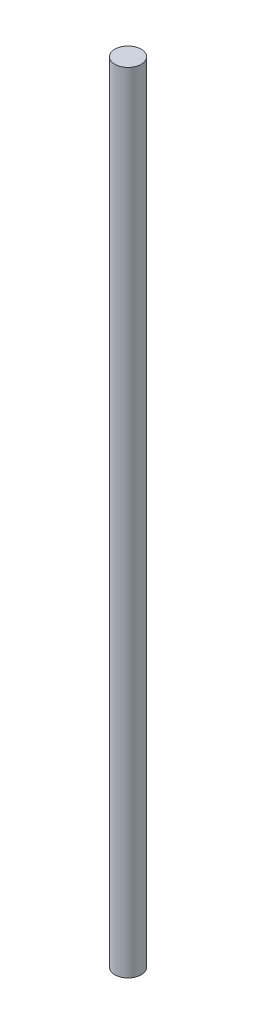
from build123d import *

# Parameters (mm, degrees)
CROQUIS1_R              = 1.5
SALIENTE_EXTRUIR1_DEPTH = 90


with BuildPart() as part:
    # Croquis1 → Saliente-Extruir1 (new body)
    with BuildSketch(Plane(origin=(0, 0, 0), x_dir=(1, 0, 0), z_dir=(0, 1, 0))):
        with Locations(Location((0, 0, 0), (0, 0, 90))):
            Circle(CROQUIS1_R)
    extrude(amount=SALIENTE_EXTRUIR1_DEPTH)


solid = part.part
